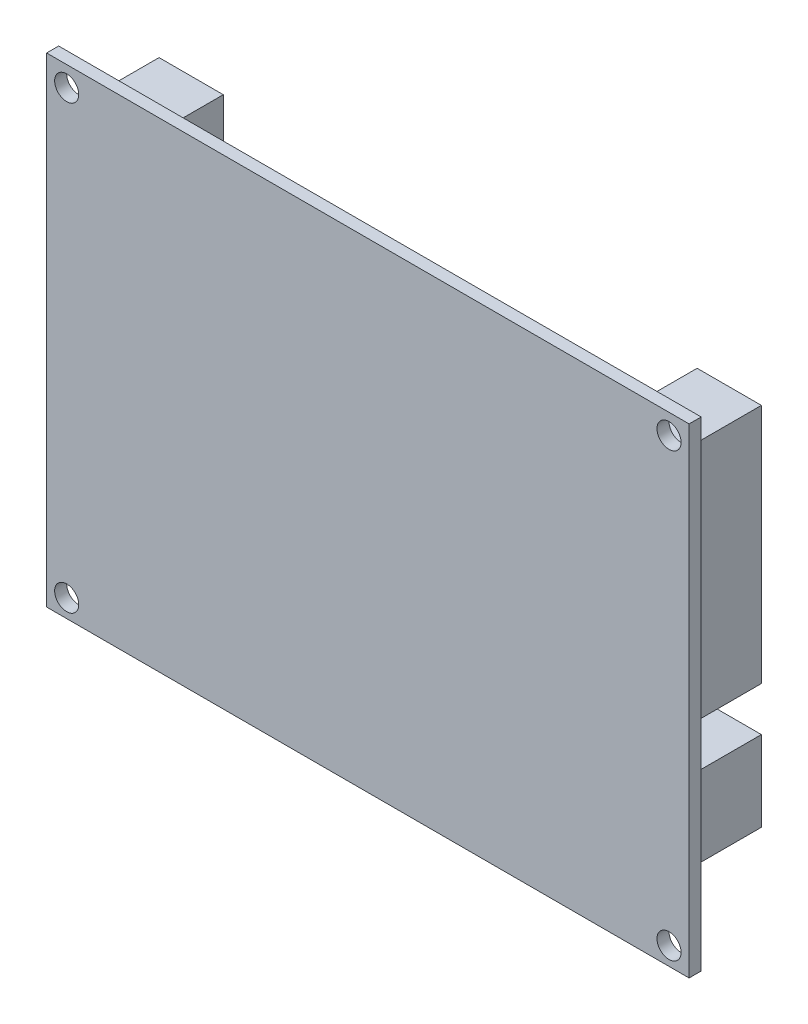
from build123d import *

# Parameters (mm, degrees)
SKETCH1_W           = 80
SKETCH1_H           = 59.75
SKETCH1_R           = 1.5
BOSS_EXTRUDE1_DEPTH = 1.5
BOSS_EXTRUDE2_START = -1.75
SKETCH1_8_W         = 50
SKETCH1_8_H         = 25
BOSS_EXTRUDE2_DEPTH = 1.5
BOSS_EXTRUDE3_START = -1.5
SKETCH1_9_W         = 8
SKETCH1_9_H         = 10
SKETCH1_9_H_2       = 13
SKETCH1_9_H_3       = 17
BOSS_EXTRUDE3_DEPTH = 10
BOSS_EXTRUDE4_START = -1.5
SKETCH1_10_W        = 7
SKETCH1_10_H        = 8
BOSS_EXTRUDE4_DEPTH = 8


with BuildPart() as part:
    # Sketch1 → Boss-Extrude1 (new body)
    with BuildSketch(Plane.XY):
        with Locations((2.001671, 7.153)):
            Rectangle(SKETCH1_W, SKETCH1_H)
        with Locations((-35.498329, -20.472)):
            Circle(SKETCH1_R, mode=Mode.SUBTRACT)
        with Locations((39.501671, -20.472)):
            Circle(SKETCH1_R, mode=Mode.SUBTRACT)
        with Locations((-35.498329, 34.528)):
            Circle(SKETCH1_R, mode=Mode.SUBTRACT)
        with Locations((39.501671, 34.528)):
            Circle(SKETCH1_R, mode=Mode.SUBTRACT)
    extrude(amount=-BOSS_EXTRUDE1_DEPTH)

    # Sketch1<9> → Boss-Extrude3 (add)
    with BuildSketch(Plane.XY.offset(BOSS_EXTRUDE3_START)):
        with Locations((-31.498329, 27.028)):
            Rectangle(SKETCH1_9_W, SKETCH1_9_H)
        with Locations((35.501671, 25.528)):
            Rectangle(SKETCH1_9_W, SKETCH1_9_H_2)
        with Locations((35.501671, 10.528)):
            Rectangle(SKETCH1_9_W, SKETCH1_9_H_3)
        with Locations((35.501671, -8.472)):
            Rectangle(SKETCH1_9_W, SKETCH1_9_H)
        with BuildLine():
            Line((-15.498329, -14.722), (-35.498329, -14.722))
            Line((-35.498329, -14.722), (-35.498329, -18.972))
            ThreePointArc((-35.498329, -18.972), (-34.437669, -19.41134), (-33.998329, -20.472))
            Line((-33.998329, -20.472), (-15.498329, -20.472))
            Line((-15.498329, -20.472), (-15.498329, -14.722))
        make_face()
        with BuildLine():
            Line((-35.498329, -21.972), (-35.498329, -22.722))
            Line((-35.498329, -22.722), (-15.498329, -22.722))
            Line((-15.498329, -22.722), (-15.498329, -20.472))
            Line((-15.498329, -20.472), (-33.998329, -20.472))
            ThreePointArc((-33.998329, -20.472), (-34.437669, -21.53266), (-35.498329, -21.972))
        make_face()
    extrude(amount=-BOSS_EXTRUDE3_DEPTH)

    # Sketch1<10> → Boss-Extrude4 (add)
    with BuildSketch(Plane.XY.offset(BOSS_EXTRUDE4_START)):
        with Locations((-31.998329, -10.472)):
            Rectangle(SKETCH1_10_W, SKETCH1_10_H)
    extrude(amount=-BOSS_EXTRUDE4_DEPTH)


with BuildPart() as body_2:
    # Sketch1<8> → Boss-Extrude2 (new body)
    with BuildSketch(Plane.XY.offset(BOSS_EXTRUDE2_START)):
        with Locations((-10.498329, 6.528)):
            Rectangle(SKETCH1_8_W, SKETCH1_8_H)
    extrude(amount=-BOSS_EXTRUDE2_DEPTH)


solid = Compound([part.part, body_2.part])
